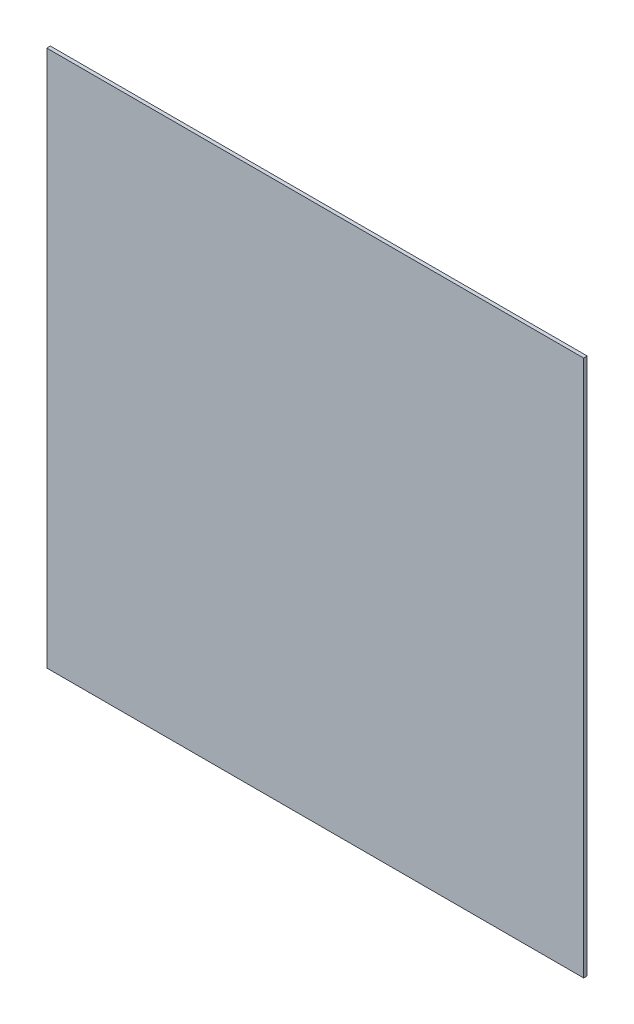
from build123d import *

# Parameters (mm, degrees)
SKETCH1_W           = 450
SKETCH1_H           = 450
BOSS_EXTRUDE1_DEPTH = 3


with BuildPart() as part:
    # Sketch1 → Boss-Extrude1 (new body)
    with BuildSketch(Plane.XY):
        with Locations((225, 225)):
            Rectangle(SKETCH1_W, SKETCH1_H)
    extrude(amount=BOSS_EXTRUDE1_DEPTH)


solid = part.part
